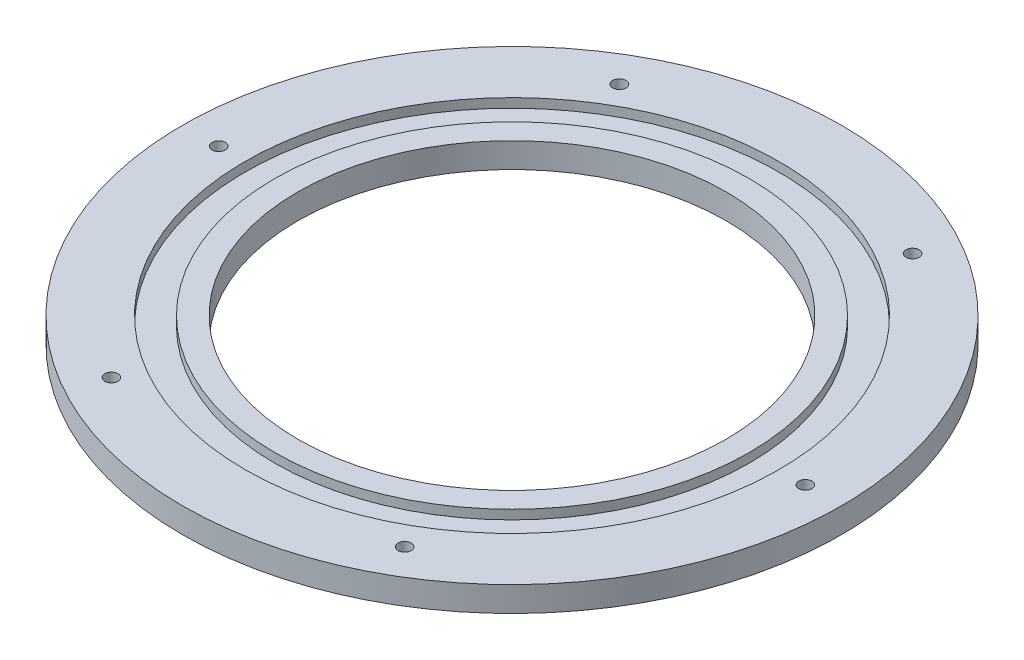
from build123d import *

# Parameters (mm, degrees)
SKETCH1_R           = 250
SKETCH1_R_2         = 162.5
BOSS_EXTRUDE1_DEPTH = 9.5
SKETCH2_R           = 202.5
SKETCH2_R_2         = 180
CUT_EXTRUDE1_DEPTH  = 7
SKETCH3_R           = 5
CUT_EXTRUDE2_DEPTH  = 355.063553617


with BuildPart() as part:
    # Sketch1 → Boss-Extrude1 (new, symmetric)
    with BuildSketch(Plane(origin=(0, 0, 0), x_dir=(1, 0, 0), z_dir=(0, 1, 0))):
        with Locations(Location((0, 0, 0), (0, 0, 270))):
            Circle(SKETCH1_R)
        with Locations(Location((0, 0, 0), (0, 0, 270))):
            Circle(SKETCH1_R_2, mode=Mode.SUBTRACT)
    extrude(amount=BOSS_EXTRUDE1_DEPTH, both=True)

    # Sketch2 → Cut-Extrude1 (cut)
    with BuildSketch(Plane(origin=(0, 9.5, 0), x_dir=(1, 0, 0), z_dir=(0, 1, 0))):
        with Locations(Location((0, 0, 0), (0, 0, 270))):
            Circle(SKETCH2_R)
        with Locations(Location((0, 0, 0), (0, 0, 270))):
            Circle(SKETCH2_R_2, mode=Mode.SUBTRACT)
    extrude(amount=-CUT_EXTRUDE1_DEPTH, mode=Mode.SUBTRACT)

    # Sketch3 → Cut-Extrude2 (cut, through all)
    with BuildSketch(Plane(origin=(0, 9.5, 0), x_dir=(1, 0, 0), z_dir=(0, 1, 0))):
        with Locations(Location((111.25, 192.690652342, 0), (0, 0, 270))):
            Circle(SKETCH3_R)
        with Locations(Location((222.5, 0, 0), (0, 0, 270))):
            Circle(SKETCH3_R)
        with Locations(Location((-222.5, 0, 0), (0, 0, 90))):
            Circle(SKETCH3_R)
        with Locations(Location((-111.25, 192.690652342, 0), (0, 0, 90))):
            Circle(SKETCH3_R)
        with Locations(Location((111.25, -192.690652342, 0), (0, 0, 90))):
            Circle(SKETCH3_R)
        with Locations(Location((-111.25, -192.690652342, 0), (0, 0, 270))):
            Circle(SKETCH3_R)
    extrude(amount=-CUT_EXTRUDE2_DEPTH, mode=Mode.SUBTRACT)


solid = part.part
